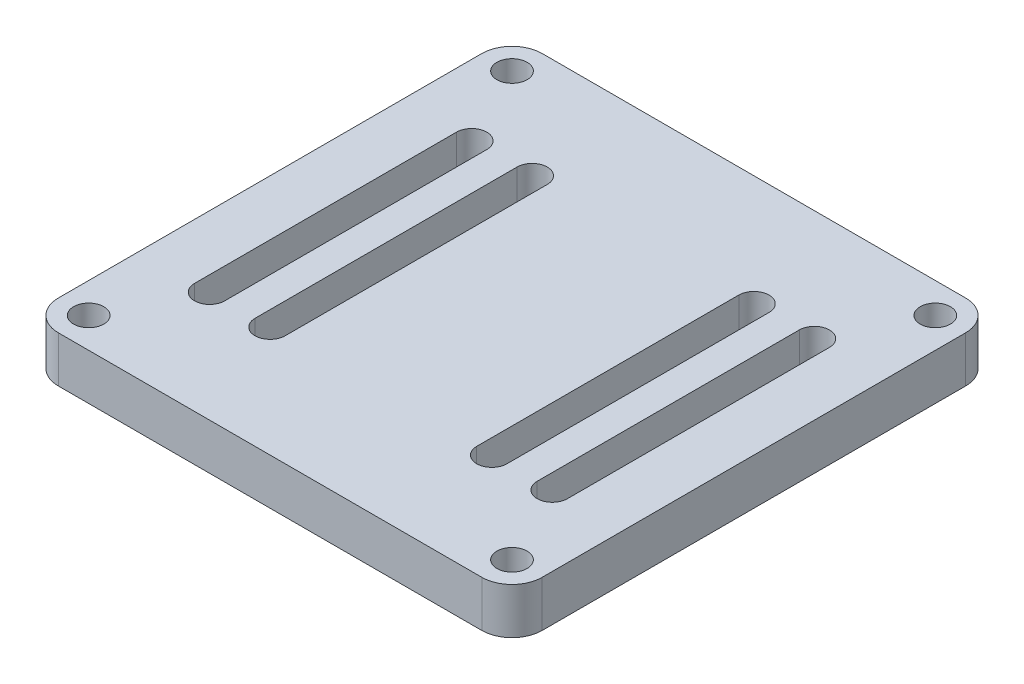
from build123d import *

# Parameters (mm, degrees)
SKETCH3_R           = 1.5
BOSS_EXTRUDE1_DEPTH = 4.572


with BuildPart() as part:
    # Sketch3 → Boss-Extrude1 (new body)
    with BuildSketch(Plane(origin=(0, 0, 0), x_dir=(1, 0, 0), z_dir=(0, 1, 0))):
        with BuildLine():
            Line((3, 0), (45, 0))
            ThreePointArc((45, 0), (47.121320344, 0.878679656), (48, 3))
            Line((48, 3), (48, 45))
            ThreePointArc((48, 45), (47.121320344, 47.121320344), (45, 48))
            Line((45, 48), (3, 48))
            ThreePointArc((3, 48), (0.878679656, 47.121320344), (0, 45))
            Line((0, 45), (0, 3))
            ThreePointArc((0, 3), (0.878679656, 0.878679656), (3, 0))
        make_face()
        with Locations(Location((3, 45, 0), (0, 0, 270))):
            Circle(SKETCH3_R, mode=Mode.SUBTRACT)
        with Locations(Location((3, 3, 0), (0, 0, 90))):
            Circle(SKETCH3_R, mode=Mode.SUBTRACT)
        with Locations(Location((45, 3, 0), (0, 0, 270))):
            Circle(SKETCH3_R, mode=Mode.SUBTRACT)
        with Locations(Location((45, 45, 0), (0, 0, 90))):
            Circle(SKETCH3_R, mode=Mode.SUBTRACT)
        with BuildLine():
            Line((8.5, 37), (8.5, 11))
            ThreePointArc((8.5, 11), (7, 9.5), (5.5, 11))
            Line((5.5, 11), (5.5, 37))
            ThreePointArc((5.5, 37), (7, 38.5), (8.5, 37))
        make_face(mode=Mode.SUBTRACT)
        with BuildLine():
            Line((11.5, 37), (11.5, 11))
            ThreePointArc((11.5, 11), (13, 9.5), (14.5, 11))
            Line((14.5, 11), (14.5, 37))
            ThreePointArc((14.5, 37), (13, 38.5), (11.5, 37))
        make_face(mode=Mode.SUBTRACT)
        with BuildLine():
            Line((36.5, 37), (36.5, 11))
            ThreePointArc((36.5, 11), (35, 9.5), (33.5, 11))
            Line((33.5, 11), (33.5, 37))
            ThreePointArc((33.5, 37), (35, 38.5), (36.5, 37))
        make_face(mode=Mode.SUBTRACT)
        with BuildLine():
            Line((39.5, 37), (39.5, 11))
            ThreePointArc((39.5, 11), (41, 9.5), (42.5, 11))
            Line((42.5, 11), (42.5, 37))
            ThreePointArc((42.5, 37), (41, 38.5), (39.5, 37))
        make_face(mode=Mode.SUBTRACT)
    extrude(amount=BOSS_EXTRUDE1_DEPTH)


solid = part.part
